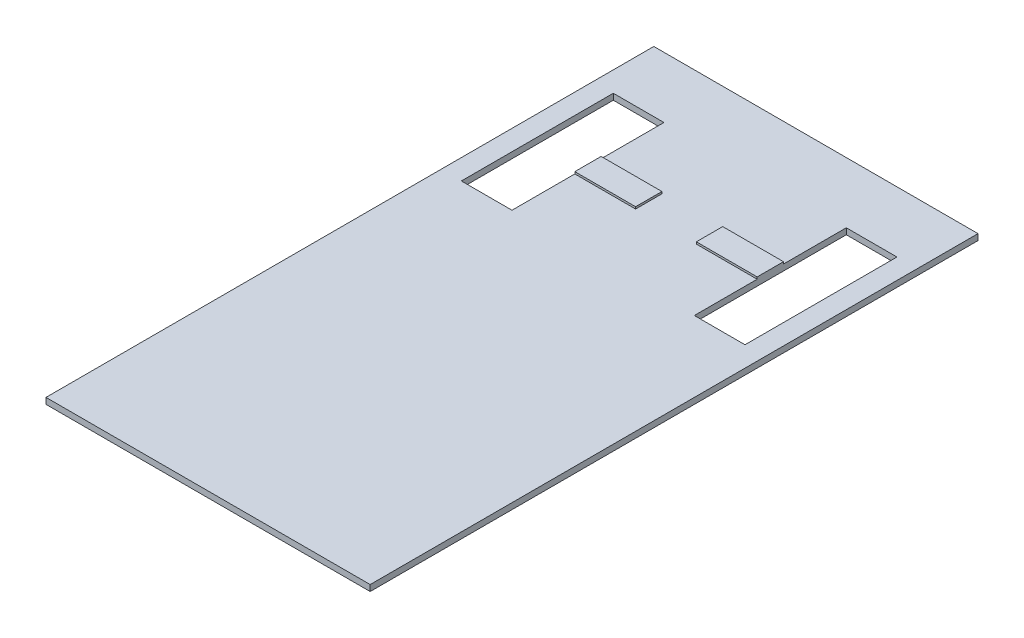
from build123d import *

# Parameters (mm, degrees)
SKETCH1_W           = 160
SKETCH1_H           = 300
BOSS_EXTRUDE1_DEPTH = 3
SKETCH1_3_W         = 30
SKETCH1_3_H         = 13
BOSS_EXTRUDE2_DEPTH = 4


with BuildPart() as part:
    # Sketch1 → Boss-Extrude1 (new body)
    with BuildSketch(Plane(origin=(0, 0, 0), x_dir=(1, 0, 0), z_dir=(0, 1, 0))):
        with Locations((120.485764952, -89.40841277)):
            Rectangle(SKETCH1_W, SKETCH1_H)
        Polygon((50.485764952, -44.40841277), (50.485764952, 30.59158723), (75.485764952, 30.59158723), (75.485764952, -0.40841277), (105.485764952, -0.40841277), (105.485764952, -13.40841277), (75.485764952, -13.40841277), (75.485764952, -44.40841277), align=None, mode=Mode.SUBTRACT)
        Polygon((165.485764952, -0.40841277), (165.485764952, 30.59158723), (190.485764952, 30.59158723), (190.485764952, -44.40841277), (165.485764952, -44.40841277), (165.485764952, -13.40841277), (135.485764952, -13.40841277), (135.485764952, -0.40841277), align=None, mode=Mode.SUBTRACT)
    extrude(amount=BOSS_EXTRUDE1_DEPTH)

    # Sketch1<3> → Boss-Extrude2 (add)
    with BuildSketch(Plane(origin=(0, 0, 0), x_dir=(1, 0, 0), z_dir=(0, 1, 0))):
        with Locations((90.485764952, -6.90841277)):
            Rectangle(SKETCH1_3_W, SKETCH1_3_H)
        with Locations((150.485764952, -6.90841277)):
            Rectangle(SKETCH1_3_W, SKETCH1_3_H)
    extrude(amount=BOSS_EXTRUDE2_DEPTH)


solid = part.part
